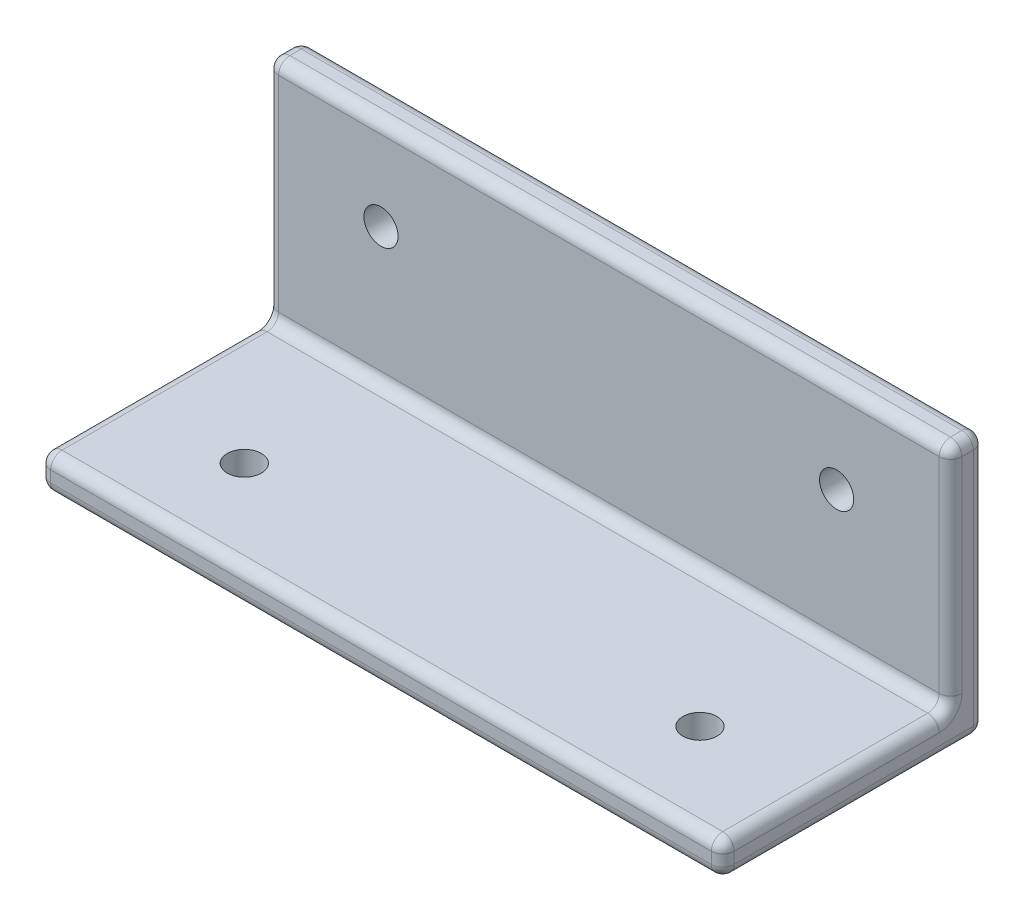
from build123d import *

# Parameters (mm, degrees)
SKETCH1_W           = 60
SKETCH1_H           = 20
BOSS_EXTRUDE1_DEPTH = 3
SKETCH3_W           = 60
SKETCH3_H           = 3
BOSS_EXTRUDE2_DEPTH = 23
FILLET2_R           = 1
SKETCH4_R           = 1.5
CUT_EXTRUDE1_DEPTH  = 39.327535793
SKETCH6_R           = 1.5
CUT_EXTRUDE2_DEPTH  = 43.766809561


with BuildPart() as part:
    # Sketch1 → Boss-Extrude1 (new body)
    with BuildSketch(Plane(origin=(0, 0, 0), x_dir=(1, 0, 0), z_dir=(0, 1, 0))):
        Rectangle(SKETCH1_W, SKETCH1_H)
    extrude(amount=BOSS_EXTRUDE1_DEPTH)

    # Sketch3 → Boss-Extrude2 (add)
    with BuildSketch(Plane(origin=(0, 0, 0), x_dir=(1, 0, 0), z_dir=(0, 1, 0))):
        with Locations((0, 11.5)):
            Rectangle(SKETCH3_W, SKETCH3_H)
    extrude(amount=BOSS_EXTRUDE2_DEPTH)

    # Fillet2
    fillet2_edges = [part.edges().sort_by_distance(p)[0] for p in [
        (0, 3, 10),
        (-30, 13, -10),
        (30, 13, -10),
        (0, 0, -13),
        (30, 11.5, -13),
        (-30, 11.5, -13),
        (30, 23, -11.5),
        (0, 23, -13),
        (-30, 3, 0),
        (-30, 23, -11.5),
        (0, 23, -10),
        (0, 3, -10),
        (-30, 0, -1.5),
        (0, 0, 10),
        (30, 0, -1.5),
        (-30, 1.5, 10),
        (30, 1.5, 10),
        (30, 3, 0),
    ]]
    fillet(fillet2_edges, radius=FILLET2_R)

    # Sketch4 → Cut-Extrude1 (cut, through all)
    with BuildSketch(Plane(origin=(0, 3, 0), x_dir=(1, 0, 0), z_dir=(0, 1, 0))):
        with Locations(Location((-20, -2, 0), (0, 0, 270))):
            Circle(SKETCH4_R)
        with Locations(Location((20, -2, 0), (0, 0, 90))):
            Circle(SKETCH4_R)
    extrude(amount=-CUT_EXTRUDE1_DEPTH, mode=Mode.SUBTRACT)

    # Sketch6 → Cut-Extrude2 (cut, through all)
    with BuildSketch(Plane.XY.offset(-10)):
        with Locations((-20, 15)):
            Circle(SKETCH6_R)
        with Locations(Location((20, 15, 0), (0, 0, 180))):
            Circle(SKETCH6_R)
    extrude(amount=-CUT_EXTRUDE2_DEPTH, mode=Mode.SUBTRACT)


solid = part.part
